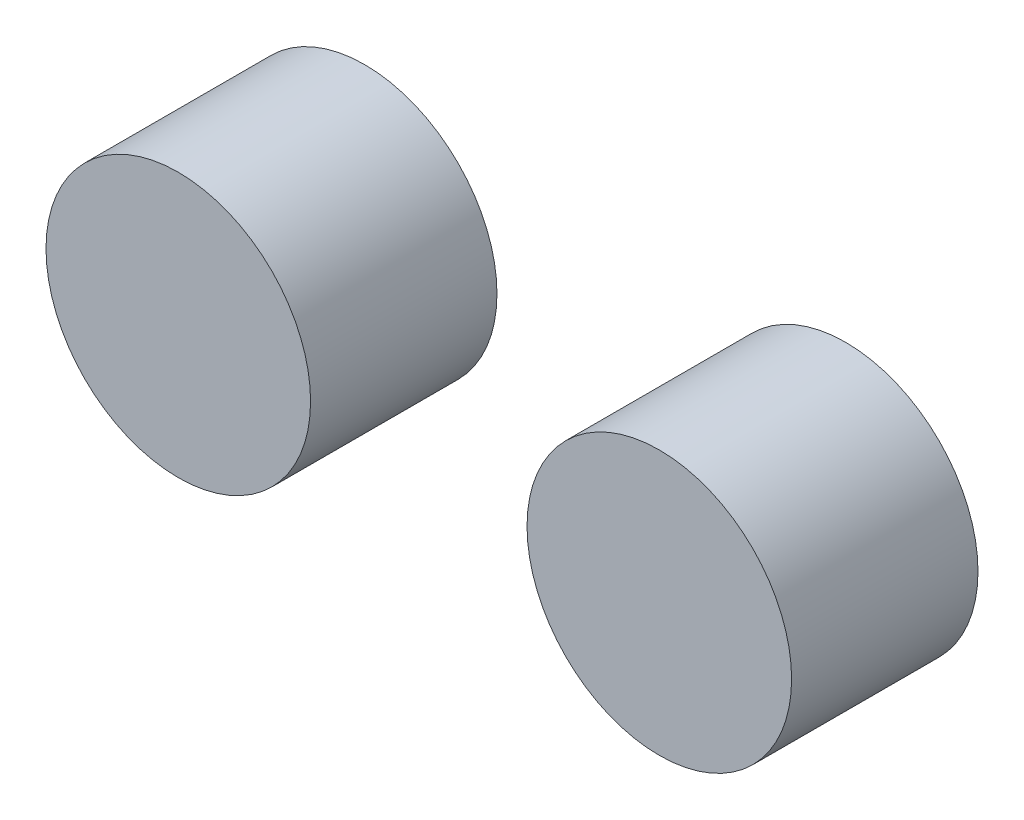
from build123d import *

# Parameters (mm, degrees)
R1_D22_VISUAL_ENVELOPE_NOT_MEASURED_START   = 1.6
SKETCH_1_R                                  = 11
R1_D22_VISUAL_ENVELOPE_NOT_MEASURED_DEPTH   = 15.5
R1_D22_VISUAL_ENVELOPE_NOT_MEASURED_2_DEPTH = 15.5


with BuildPart() as part:
    # 草图1 → R1_D22_visual_envelope_NOT_measured (new body)
    with BuildSketch(Plane.XY.offset(R1_D22_VISUAL_ENVELOPE_NOT_MEASURED_START)):
        with Locations((-20, 60)):
            Circle(SKETCH_1_R)
    extrude(amount=R1_D22_VISUAL_ENVELOPE_NOT_MEASURED_DEPTH)


with BuildPart() as body_2:
    # 草图1 → R1_D22_visual_envelope_NOT_measured 2 (new body)
    with BuildSketch(Plane.XY.offset(R1_D22_VISUAL_ENVELOPE_NOT_MEASURED_START)):
        with Locations((20, 60)):
            Circle(SKETCH_1_R)
    extrude(amount=R1_D22_VISUAL_ENVELOPE_NOT_MEASURED_2_DEPTH)


solid = Compound([part.part, body_2.part])
